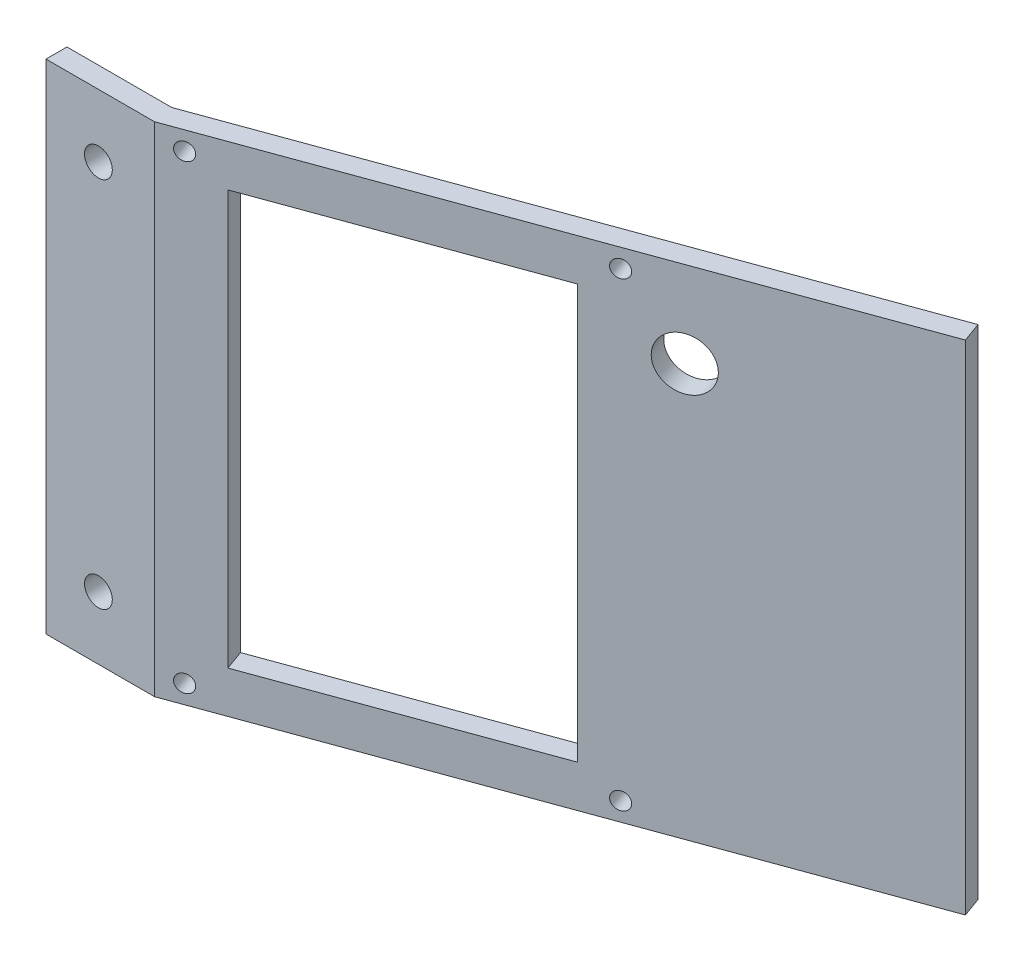
from build123d import *

# Parameters (mm, degrees)
SKETCH1_W           = 95
SKETCH1_H           = 20
SKETCH1_R           = 2.65
BOSS_EXTRUDE1_DEPTH = 4
BOSS_EXTRUDE2_DEPTH = 95
SKETCH3_R           = 1.65
SKETCH3_R_2         = 5
SKETCH3_W           = 79
SKETCH3_H           = 52
CUT_EXTRUDE1_DEPTH  = 140.048139578


with BuildPart() as part:
    # Sketch1 → Boss-Extrude1 (new body)
    with BuildSketch(Plane(origin=(0, 0, 0), x_dir=(0, 1, 0), z_dir=(0, 0, 1))):
        Rectangle(SKETCH1_W, SKETCH1_H)
        with Locations(Location((35.5, 0, 0), (0, 0, 270))):
            Circle(SKETCH1_R, mode=Mode.SUBTRACT)
        with Locations(Location((-35.5, 0, 0), (0, 0, 270))):
            Circle(SKETCH1_R, mode=Mode.SUBTRACT)
    extrude(amount=BOSS_EXTRUDE1_DEPTH)

    # Sketch2 → Boss-Extrude2 (add)
    with BuildSketch(Plane.XZ.offset(47.5)):
        Polygon((10, 0), (122.763114494, -41.042417199), (124.131195068, -37.283646716), (10.705307923, 4), (10, 4), align=None)
    extrude(amount=-BOSS_EXTRUDE2_DEPTH)

    # Sketch3 → Cut-Extrude1 (cut, through all)
    with BuildSketch(Plane(origin=(1.169777784, 0, 3.213938048), x_dir=(0, -1, 0), z_dir=(-0.34202014332566977, 0, -0.9396926207859081))):
        with Locations(Location((43.95, -13.168790985, 0), (0, 0, 90))):
            Circle(SKETCH3_R)
        with Locations(Location((43.95, -78.068790985, 0), (0, 0, 90))):
            Circle(SKETCH3_R)
        with Locations(Location((-43.95, -78.068790985, 0), (0, 0, 90))):
            Circle(SKETCH3_R)
        with Locations(Location((-43.95, -13.168790985, 0), (0, 0, 90))):
            Circle(SKETCH3_R)
        with Locations(Location((-31.1, -87.618790985, 0), (0, 0, 90))):
            Circle(SKETCH3_R_2)
        with Locations((0, -45.618790985)):
            Rectangle(SKETCH3_W, SKETCH3_H)
    extrude(amount=-CUT_EXTRUDE1_DEPTH, mode=Mode.SUBTRACT)


solid = part.part
